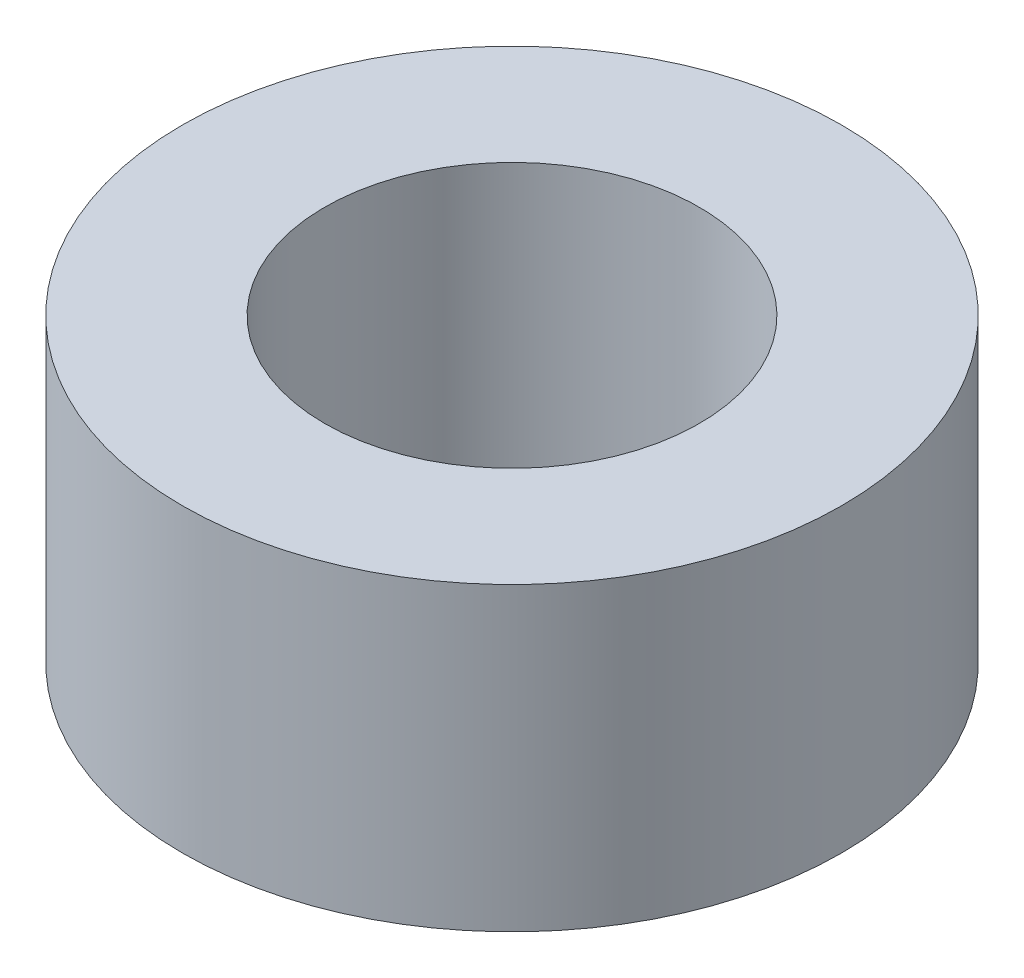
from build123d import *

# Parameters (mm, degrees)
SKETCH1_R           = 5.4991
SKETCH1_R_2         = 3.125
BOSS_EXTRUDE1_DEPTH = 5.0165


with BuildPart() as part:
    # Sketch1 → Boss-Extrude1 (new body)
    with BuildSketch(Plane(origin=(0, 0, 0), x_dir=(1, 0, 0), z_dir=(0, 1, 0))):
        with Locations(Location((0, 0, 0), (0, 0, 270))):
            Circle(SKETCH1_R)
        with Locations(Location((0, 0, 0), (0, 0, 270))):
            Circle(SKETCH1_R_2, mode=Mode.SUBTRACT)
    extrude(amount=BOSS_EXTRUDE1_DEPTH)


solid = part.part
